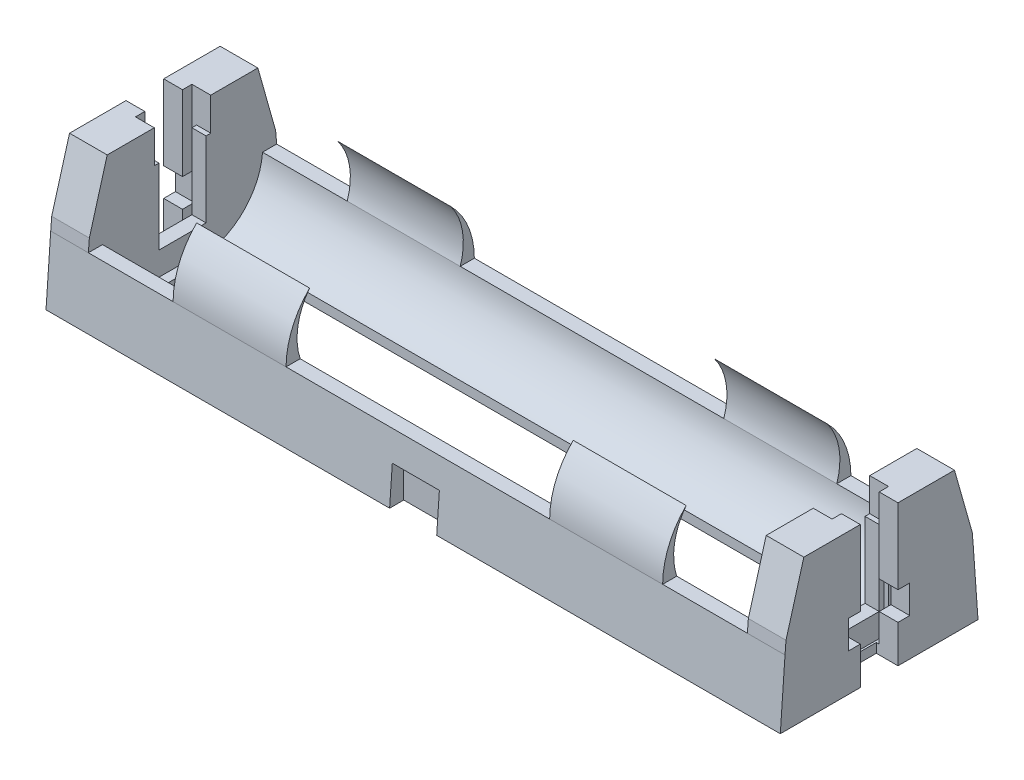
from build123d import *

# Parameters (mm, degrees)
SKETCH1_W            = 78
SKETCH1_H            = 21
BOSS_EXTRUDE1_DEPTH  = 7
CUT_EXTRUDE1_DEPTH   = 80.014239223
SKETCH3_W            = 70
SKETCH3_H            = 8
CUT_EXTRUDE2_DEPTH   = 6
CUT_EXTRUDE3_DEPTH   = 70
SKETCH5_W            = 68
SKETCH5_H            = 8
CUT_EXTRUDE4_DEPTH   = 41.831972766
BOSS_EXTRUDE2_DEPTH  = 12
MIRROR3_COPY_1_DEPTH = 12
BOSS_EXTRUDE3_DEPTH  = 4
SKETCH9_W            = 6.5
SKETCH9_H            = 3
CUT_EXTRUDE5_DEPTH   = 2
CUT_EXTRUDE6_DEPTH   = 2
SKETCH12_W           = 0.5
SKETCH12_H           = 6
CUT_EXTRUDE8_DEPTH   = 10.5
SKETCH13_W           = 4.001855858
SKETCH13_H           = 15
CUT_EXTRUDE9_DEPTH   = 2.3
SKETCH14_W           = 5
SKETCH14_H           = 1.5
CUT_EXTRUDE10_DEPTH  = 4


with BuildPart() as part:
    # Sketch1 → Boss-Extrude1 (new body)
    with BuildSketch(Plane(origin=(0, 0, 0), x_dir=(1, 0, 0), z_dir=(0, 1, 0))):
        Rectangle(SKETCH1_W, SKETCH1_H)
    extrude(amount=BOSS_EXTRUDE1_DEPTH)

    # Sketch2 → Cut-Extrude1 (cut, through all)
    with BuildSketch(Plane(origin=(39, 0, 0), x_dir=(0, 0, -1), z_dir=(1, 0, 0))):
        Polygon((10, 7), (10.5, 0), (10.5, 7), align=None)
        Polygon((-10, 7), (-10.5, 0), (-10.5, 7), align=None)
    extrude(amount=-CUT_EXTRUDE1_DEPTH, mode=Mode.SUBTRACT)

    # Sketch3 → Cut-Extrude2 (cut)
    with BuildSketch(Plane(origin=(0, 7, 0), x_dir=(1, 0, 0), z_dir=(0, 1, 0))):
        Rectangle(SKETCH3_W, SKETCH3_H)
    extrude(amount=-CUT_EXTRUDE2_DEPTH, mode=Mode.SUBTRACT)

    # Sketch4 → Cut-Extrude3 (cut)
    with BuildSketch(Plane(origin=(35, 0, 0), x_dir=(0, 0, -1), z_dir=(1, 0, 0))):
        with BuildLine():
            Line((4, 1), (4, 7))
            Line((4, 7), (8.5, 7))
            ThreePointArc((8.5, 7), (7.132310367, 3.338267225), (4, 1))
        make_face()
    cut_extrude3 = extrude(amount=-CUT_EXTRUDE3_DEPTH, mode=Mode.SUBTRACT)

    # Mirror1: Cut-Extrude3 across plane
    add(cut_extrude3.mirror(Plane.XY), mode=Mode.SUBTRACT)

    # Sketch5 → Cut-Extrude4 (cut, through all)
    with BuildSketch(Plane(origin=(0, 1, 0), x_dir=(1, 0, 0), z_dir=(0, 1, 0))):
        Rectangle(SKETCH5_W, SKETCH5_H)
    extrude(amount=-CUT_EXTRUDE4_DEPTH, mode=Mode.SUBTRACT)

    # Sketch6 → Boss-Extrude2 (add)
    with BuildSketch(Plane(origin=(26, 0, 0), x_dir=(0, 0, -1), z_dir=(1, 0, 0))):
        with BuildLine():
            Line((-10, 7), (-8.5, 7))
            ThreePointArc((-8.5, 7), (-8.740958247, 10.123493041), (-7.5, 13))
            ThreePointArc((-7.5, 13), (-9.343954985, 10.247481244), (-10, 7))
        make_face()
    boss_extrude2 = extrude(amount=-BOSS_EXTRUDE2_DEPTH)

    # Mirror2: Boss-Extrude2 across plane
    add(boss_extrude2.mirror(Plane(origin=(0, 0, 0), x_dir=(0, 0, 1), z_dir=(1, 0, 0))))

    # Mirror3: Boss-Extrude2 across plane
    add(boss_extrude2.mirror(Plane.XY))

    # Mirror3 copy 1 sketch → Mirror3 copy 1 (add)
    with BuildSketch(Plane.ZY.offset(26)):
        with BuildLine():
            Line((-10, 7), (-8.5, 7))
            ThreePointArc((-8.5, 7), (-8.740958247, 10.123493041), (-7.5, 13))
            ThreePointArc((-7.5, 13), (-9.343954985, 10.247481244), (-10, 7))
        make_face()
    extrude(amount=-MIRROR3_COPY_1_DEPTH)

    # Sketch8 → Boss-Extrude3 (add)
    with BuildSketch(Plane(origin=(39, 0, 0), x_dir=(0, 0, -1), z_dir=(1, 0, 0))):
        Polygon((-8, 15), (8, 15), (9.894572253, 8.304261216), (10, 7), (-10, 7), (-9.894572253, 8.304261216), align=None)
    boss_extrude3 = extrude(amount=-BOSS_EXTRUDE3_DEPTH)

    # Mirror4: Boss-Extrude3 across plane
    add(boss_extrude3.mirror(Plane(origin=(0, 0, 0), x_dir=(0, 0, 1), z_dir=(1, 0, 0))))

    # Sketch9 → Cut-Extrude5 (cut)
    with BuildSketch(Plane(origin=(39, 0, 0), x_dir=(0, 0, -1), z_dir=(1, 0, 0))):
        with Locations((0, 5.5)):
            Rectangle(SKETCH9_W, SKETCH9_H)
    cut_extrude5 = extrude(amount=-CUT_EXTRUDE5_DEPTH, mode=Mode.SUBTRACT)

    # Mirror5: Cut-Extrude5 across plane
    add(cut_extrude5.mirror(Plane(origin=(0, 0, 0), x_dir=(0, 0, 1), z_dir=(1, 0, 0))), mode=Mode.SUBTRACT)

    # Sketch11 → Cut-Extrude6 (cut)
    with BuildSketch(Plane.ZY.offset(-35)):
        Polygon((-2.5, 3.5), (2.5, 3.5), (2.5, 11.5), (3, 11.5), (3, 15), (-3, 15), (-3, 11.5), (-2.5, 11.5), align=None)
    cut_extrude6 = extrude(amount=-CUT_EXTRUDE6_DEPTH, mode=Mode.SUBTRACT)

    # Sketch12 → Cut-Extrude8 (cut)
    with BuildSketch(Plane(origin=(0, 11.5, 0), x_dir=(1, 0, 0), z_dir=(0, 1, 0))):
        with Locations((36.75, 0)):
            Rectangle(SKETCH12_W, SKETCH12_H)
    cut_extrude8 = extrude(amount=-CUT_EXTRUDE8_DEPTH, mode=Mode.SUBTRACT)

    # Sketch13 → Cut-Extrude9 (cut)
    with BuildSketch(Plane(origin=(39, 0, 0), x_dir=(0, 0, -1), z_dir=(1, 0, 0))):
        with Locations((0, 7.5)):
            Rectangle(SKETCH13_W, SKETCH13_H)
    cut_extrude9 = extrude(amount=-CUT_EXTRUDE9_DEPTH, mode=Mode.SUBTRACT)

    # Mirror6: Cut-Extrude6, Cut-Extrude8, Cut-Extrude9 across plane
    add(cut_extrude6.mirror(Plane(origin=(0, 0, 0), x_dir=(0, 0, 1), z_dir=(1, 0, 0))), mode=Mode.SUBTRACT)
    add(cut_extrude8.mirror(Plane(origin=(0, 0, 0), x_dir=(0, 0, 1), z_dir=(1, 0, 0))), mode=Mode.SUBTRACT)
    add(cut_extrude9.mirror(Plane(origin=(0, 0, 0), x_dir=(0, 0, 1), z_dir=(1, 0, 0))), mode=Mode.SUBTRACT)

    # Sketch14 → Cut-Extrude10 (cut)
    with BuildSketch(Plane.XZ):
        with Locations((0, 9.75)):
            Rectangle(SKETCH14_W, SKETCH14_H)
    cut_extrude10 = extrude(amount=-CUT_EXTRUDE10_DEPTH, mode=Mode.SUBTRACT)

    # Mirror7: Cut-Extrude10 across plane
    add(cut_extrude10.mirror(Plane.XY), mode=Mode.SUBTRACT)


solid = part.part
